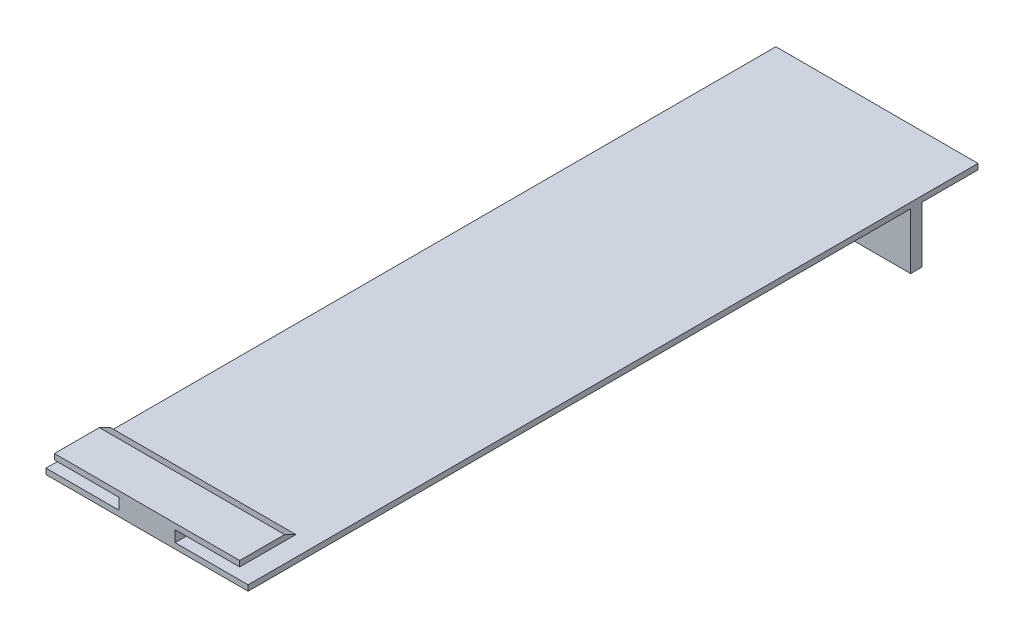
from build123d import *

# Parameters (mm, degrees)
SKETCH1_W           = 36
SKETCH1_H           = 1
BOSS_EXTRUDE1_DEPTH = 65
BOSS_EXTRUDE2_DEPTH = 5
SKETCH3_W           = 36
SKETCH3_H           = 2
BOSS_EXTRUDE3_DEPTH = 10
CUT_EXTRUDE1_REACH  = 76.334


with BuildPart() as part:
    # Sketch1 → Boss-Extrude1 (new, symmetric)
    with BuildSketch(Plane.XY):
        Rectangle(SKETCH1_W, SKETCH1_H)
    extrude(amount=BOSS_EXTRUDE1_DEPTH, both=True)

    # Sketch2 → Boss-Extrude2 (add, symmetric)
    with BuildSketch(Plane.XY.offset(60)):
        Polygon((-5, 0.5), (-5, 2.5), (-16.5, 2.5), (-16.5, 3.5), (16.5, 3.5), (16.5, 2.5), (5, 2.5), (5, 0.5), align=None)
    extrude(amount=BOSS_EXTRUDE2_DEPTH, both=True)

    # Sketch3 → Boss-Extrude3 (add)
    with BuildSketch(Plane.XZ.offset(0.5)):
        with Locations((0, -54)):
            Rectangle(SKETCH3_W, SKETCH3_H)
    extrude(amount=BOSS_EXTRUDE3_DEPTH)

    # Sketch4 → Cut-Extrude1 (cut, up to next)
    with BuildSketch(Plane(origin=(16.5, 0, 0), x_dir=(0, 0, -1), z_dir=(1, 0, 0)), mode=Mode.PRIVATE) as cut_extrude1_sk1:
        Polygon((-57, 3.5), (-55, 2.5), (-55, 3.5), align=None)
    cut_extrude1_tool1 = extrude(cut_extrude1_sk1.sketch, amount=-CUT_EXTRUDE1_REACH, mode=Mode.PRIVATE) & part.part
    add(cut_extrude1_tool1.solids().sort_by_distance((16.5, 3.166667, 55.666667))[0], mode=Mode.SUBTRACT)


solid = part.part
